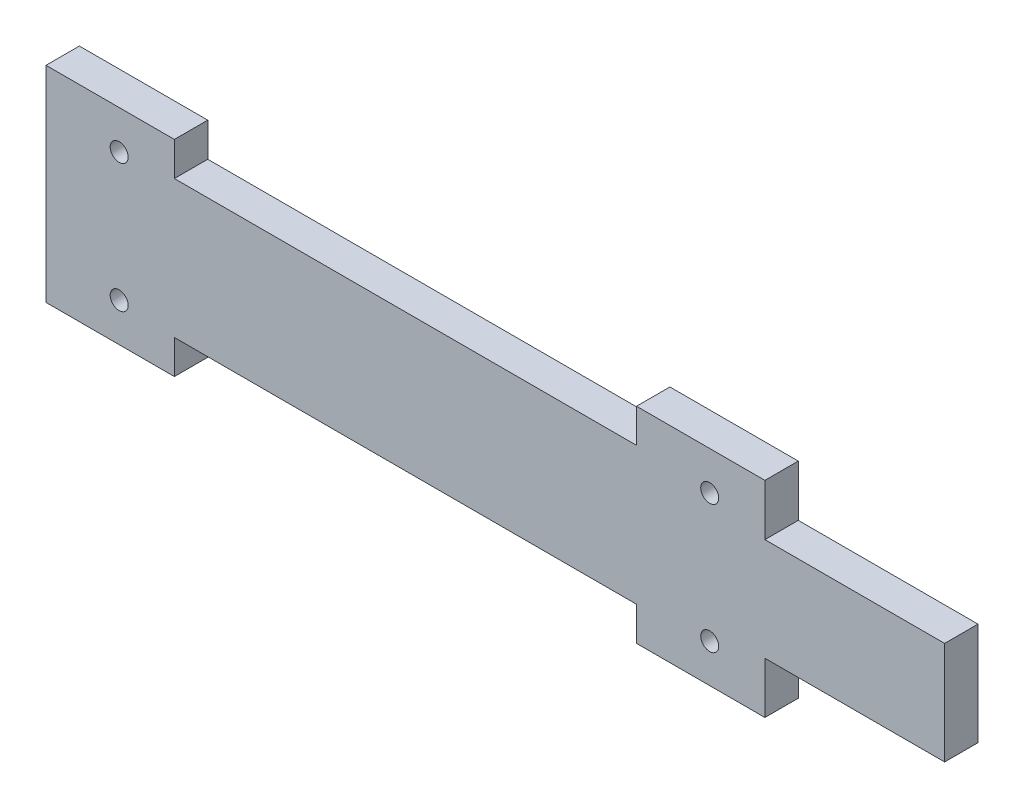
from build123d import *

# Parameters (mm, degrees)
SKETCH1_R           = 3.5
BOSS_EXTRUDE1_DEPTH = 13


with BuildPart() as part:
    # Sketch1 → Boss-Extrude1 (new body)
    with BuildSketch(Plane.XY):
        Polygon((-103.143983002, -40), (-103.143983002, 40), (-53.143983002, 40), (-53.143983002, 26.804123711), (126.856016998, 26.804123711), (126.856016998, 40), (176.856016998, 40), (176.856016998, 20), (246.856016998, 20), (246.856016998, -20), (176.856016998, -20), (176.856016998, -40), (126.856016998, -40), (126.856016998, -26.804123711), (-53.143983002, -26.804123711), (-53.143983002, -40), align=None)
        with Locations(Location((-74.643983002, 25, 0), (0, 0, 180))):
            Circle(SKETCH1_R, mode=Mode.SUBTRACT)
        with Locations(Location((155.356016998, 25, 0), (0, 0, 180))):
            Circle(SKETCH1_R, mode=Mode.SUBTRACT)
        with Locations(Location((155.356016998, -25, 0), (0, 0, 180))):
            Circle(SKETCH1_R, mode=Mode.SUBTRACT)
        with Locations(Location((-74.643983002, -25, 0), (0, 0, 180))):
            Circle(SKETCH1_R, mode=Mode.SUBTRACT)
    extrude(amount=BOSS_EXTRUDE1_DEPTH)


solid = part.part
